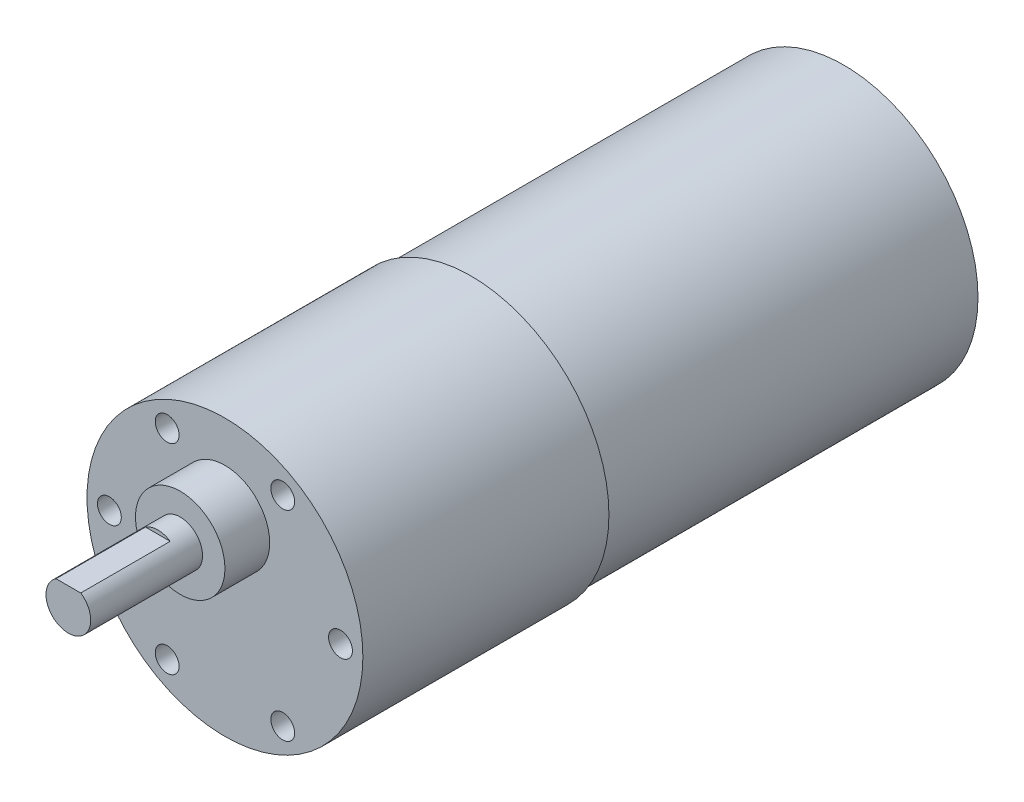
from build123d import *

# Parameters (mm, degrees)
SKETCH_1_R          = 18.5
EXTRUDE_1_DEPTH     = 33
SKETCH_2_R          = 18
EXTRUDE_2_DEPTH     = 50
SKETCH_3_R          = 1.6
CUT_EXTRUDE_1_DEPTH = 6
SKETCH_4_R          = 6
EXTRUDE_3_DEPTH     = 6
SKETCH_5_R          = 3
EXTRUDE_4_DEPTH     = 15
CUT_EXTRUDE_START   = -12
CUT_EXTRUDE_2_DEPTH = 12


with BuildPart() as part:
    # 草图1 → 凸台-拉伸1 (new body)
    with BuildSketch(Plane.XY):
        Circle(SKETCH_1_R)
    extrude(amount=EXTRUDE_1_DEPTH)

    # 草图2 → 凸台-拉伸2 (add)
    with BuildSketch(Plane(origin=(0, 0, 0), x_dir=(-1, 0, 0), z_dir=(0, 0, -1))):
        Circle(SKETCH_2_R)
    extrude(amount=EXTRUDE_2_DEPTH)

    # 草图3 → 切除-拉伸1 (cut)
    with BuildSketch(Plane.XY.offset(33)):
        with Locations((-15.5, 0)):
            Circle(SKETCH_3_R)
        with Locations((-7.75, 13.423393759)):
            Circle(SKETCH_3_R)
        with Locations((7.75, 13.423393759)):
            Circle(SKETCH_3_R)
        with Locations((15.5, 0)):
            Circle(SKETCH_3_R)
        with Locations((7.75, -13.423393759)):
            Circle(SKETCH_3_R)
        with Locations((-7.75, -13.423393759)):
            Circle(SKETCH_3_R)
    extrude(amount=-CUT_EXTRUDE_1_DEPTH, mode=Mode.SUBTRACT)

    # 草图4 → 凸台-拉伸3 (add)
    with BuildSketch(Plane.XY.offset(33)):
        with Locations((0, 7)):
            Circle(SKETCH_4_R)
    extrude(amount=EXTRUDE_3_DEPTH)

    # 草图5 → 凸台-拉伸4 (add)
    with BuildSketch(Plane.XY.offset(39)):
        with Locations((0, 7)):
            Circle(SKETCH_5_R)
    extrude(amount=EXTRUDE_4_DEPTH)

    # 草图6 → 切除-拉伸2 (cut)
    with BuildSketch(Plane.XY.offset(54).offset(CUT_EXTRUDE_START)):
        with BuildLine():
            Line((-1.658312395, 9.5), (1.658312395, 9.5))
            ThreePointArc((1.658312395, 9.5), (0, 10), (-1.658312395, 9.5))
        make_face()
    extrude(amount=CUT_EXTRUDE_2_DEPTH, mode=Mode.SUBTRACT)


solid = part.part
